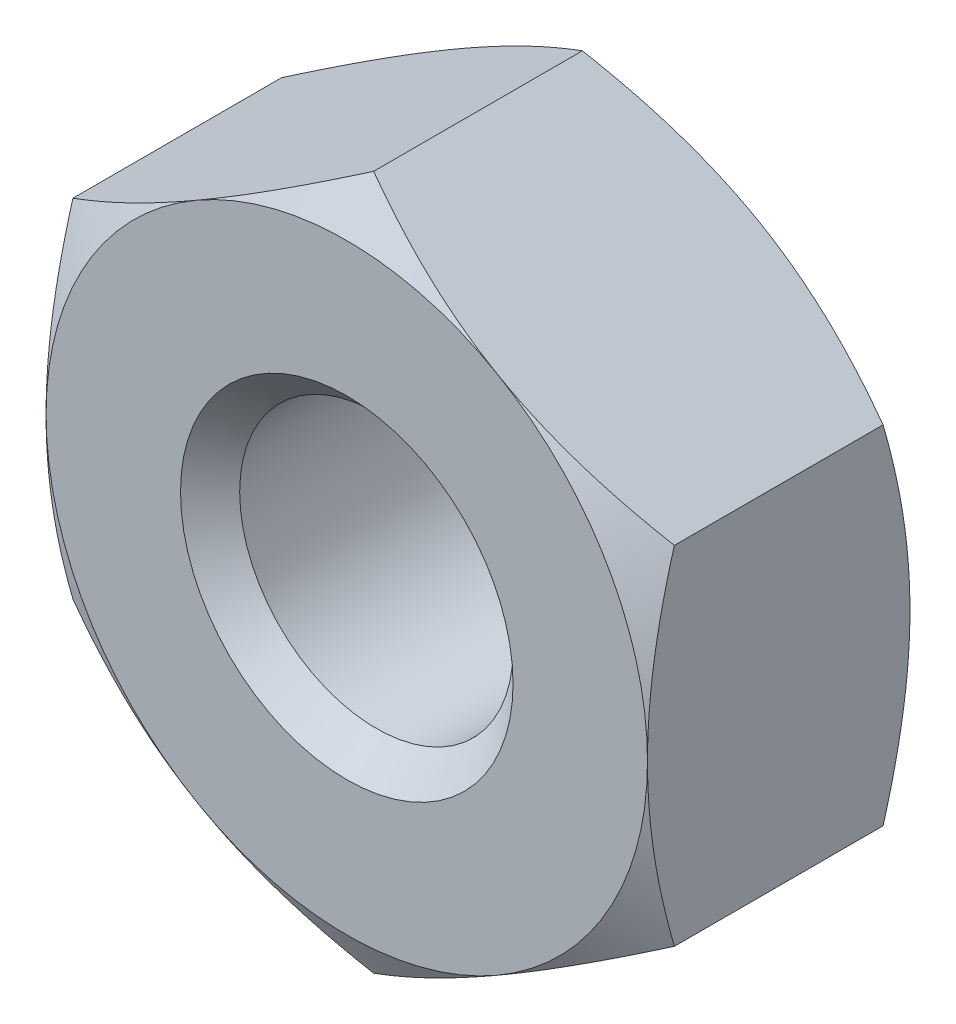
from build123d import *

# Parameters (mm, degrees)
SKETCH2_R           = 1.25
BOSS_EXTRUDE1_DEPTH = 1.2
CHAMFER1_SIZE       = 0.2705


with BuildPart() as part:
    # Sketch2 → Boss-Extrude1 (new, symmetric)
    with BuildSketch(Plane.XY):
        Polygon((2.75, 1.58771324), (2.75, -1.58771324), (0, -3.175426481), (-2.75, -1.58771324), (-2.75, 1.58771324), (0, 3.175426481), align=None)
        Circle(SKETCH2_R, mode=Mode.SUBTRACT)
    extrude(amount=BOSS_EXTRUDE1_DEPTH, both=True)

    # Sketch4 → Cut-Revolve2 (revolve, cut)
    with BuildSketch(Plane(origin=(0, 0, 0), x_dir=(0, 0, -1), z_dir=(1, 0, 0))):
        Polygon((1.2, 2.75), (1.2, 4.328660734), (0.2885598, 4.328660734), align=None)
    cut_revolve2 = revolve(axis=Axis((0, 0, 2.99453507), (0, 0, -1)), mode=Mode.SUBTRACT)

    # Mirror1: Cut-Revolve2 across plane
    add(cut_revolve2.mirror(Plane.XY), mode=Mode.SUBTRACT)

    # Chamfer1
    chamfer1_edges = [part.edges().sort_by_distance(p)[0] for p in [
        (-1.25, 0, -1.2),
        (-1.25, 0, 1.2),
    ]]
    chamfer(chamfer1_edges, length=CHAMFER1_SIZE)


solid = part.part
